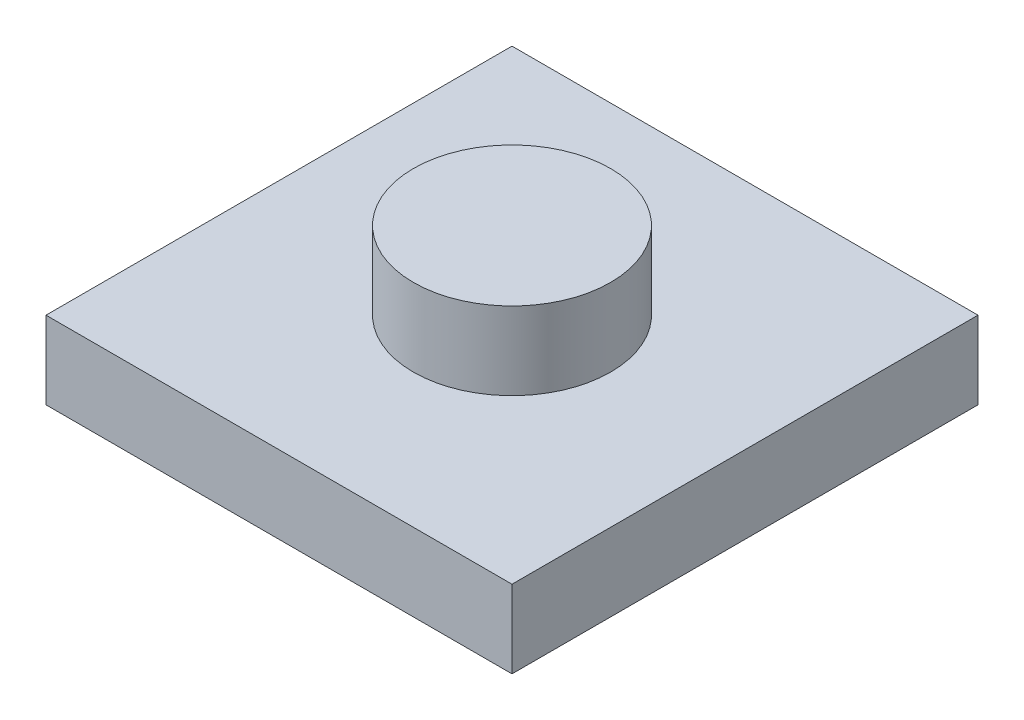
from build123d import *

# Parameters (mm, degrees)
SKETCH1_W           = 90
SKETCH1_H           = 90
SKETCH1_R           = 19.05
BOSS_EXTRUDE1_DEPTH = 15
SKETCH1_2_R         = 19.05
BOSS_EXTRUDE2_DEPTH = 30


with BuildPart() as part:
    # Sketch1 → Boss-Extrude1 (new body)
    with BuildSketch(Plane(origin=(0, 0, 0), x_dir=(1, 0, 0), z_dir=(0, 1, 0))):
        Rectangle(SKETCH1_W, SKETCH1_H)
        Circle(SKETCH1_R, mode=Mode.SUBTRACT)
    extrude(amount=BOSS_EXTRUDE1_DEPTH)

    # Sketch1<2> → Boss-Extrude2 (add)
    with BuildSketch(Plane(origin=(0, 0, 0), x_dir=(1, 0, 0), z_dir=(0, 1, 0))):
        Circle(SKETCH1_2_R)
    extrude(amount=BOSS_EXTRUDE2_DEPTH)


solid = part.part
